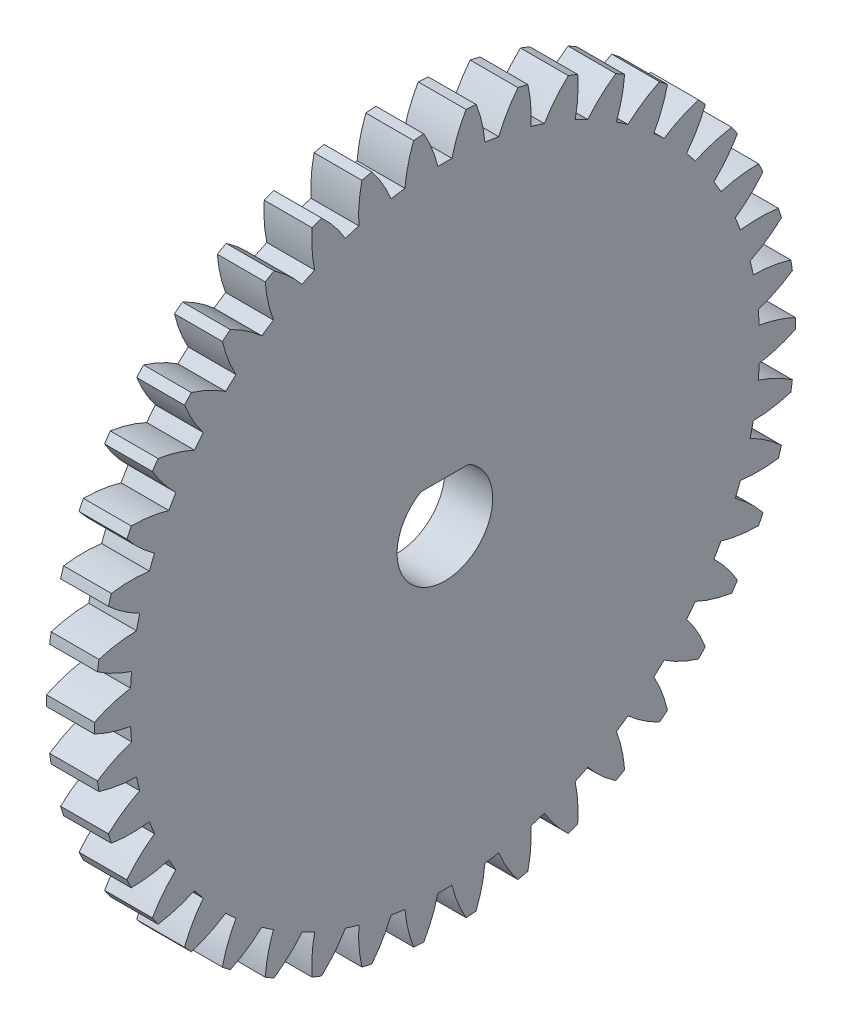
from build123d import *

# Parameters (mm, degrees)
BASPROSKE_W         = 6
BASPROSKE_H         = 44
TOOTHCUT_DEPTH      = 63.513998432
TEETHCUTS_COUNT     = 42
TEETHCUTS_ANGLE     = 351.428571429
BORSKE_R            = 6
BORE_DEPTH          = 50.0000508
BOSS_EXTRUDE2_DEPTH = 6


with BuildPart() as part:
    # BasProSke → Base-Revolve (revolve)
    with BuildSketch(Plane(origin=(0, 0, 0), x_dir=(1, 0, 0), z_dir=(0, 1, 0)), mode=Mode.PRIVATE) as base_revolve_sk:
        with Locations((3, 22)):
            Rectangle(BASPROSKE_W, BASPROSKE_H)
    revolve(base_revolve_sk.sketch.rotate(Axis((-10, 0, 0), (1, 0, 0)), 180), axis=Axis((-10, 0, 0), (1, 0, 0)))

    # TooCutSke → ToothCut (cut, through all)
    with BuildSketch(Plane(origin=(0, 0, 0), x_dir=(0, 0, -1), z_dir=(1, 0, 0))):
        with BuildLine():
            ThreePointArc((0.877582471, 39.489249803), (0, 39.499), (-0.877582471, 39.489249803))
            ThreePointArc((-0.877582471, 39.489249803), (-1.612128187, 41.781146885), (-2.666625076, 43.944566853))
            ThreePointArc((-2.666625076, 43.944566853), (0, 44.0254), (2.666625076, 43.944566853))
            ThreePointArc((2.666625076, 43.944566853), (1.612128187, 41.781146885), (0.877582471, 39.489249803))
        make_face()
    toothcut = extrude(amount=TOOTHCUT_DEPTH, mode=Mode.SUBTRACT)

    # TeethCuts: ToothCut ×42 about axis
    teethcuts_axis = Axis((-10, 0, 0), (1, 0, 0))
    for i in range(1, TEETHCUTS_COUNT):
        add(toothcut.rotate(teethcuts_axis, i * TEETHCUTS_ANGLE / (TEETHCUTS_COUNT - 1)), mode=Mode.SUBTRACT)

    # BorSke → Bore (cut, symmetric)
    with BuildSketch(Plane(origin=(0, 0, 0), x_dir=(0, 0, -1), z_dir=(1, 0, 0))):
        with Locations(Location((0, 0, 0), (0, 0, 180))):
            Circle(BORSKE_R)
    extrude(amount=BORE_DEPTH, both=True, mode=Mode.SUBTRACT)

    # Sketch1 → Boss-Extrude2 (add)
    with BuildSketch(Plane(origin=(6, 0, 0), x_dir=(0, 0, -1), z_dir=(1, 0, 0))):
        with BuildLine():
            Line((-3, 5.196152423), (3, 5.196152423))
            ThreePointArc((3, 5.196152423), (0, 6), (-3, 5.196152423))
        make_face()
    extrude(amount=-BOSS_EXTRUDE2_DEPTH)


solid = part.part
